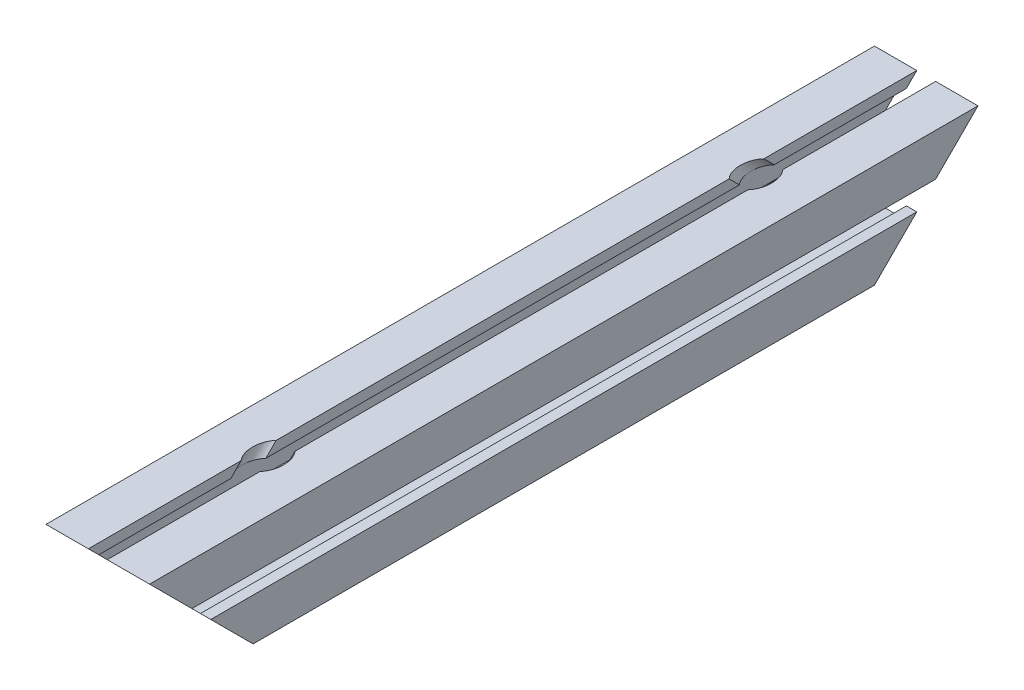
from build123d import *

# Parameters (mm, degrees)
SKETCH1_R      = 6
SKETCH1_R_2    = 3.75
EXTRUDE1_DEPTH = 180
EXTRUDE2_DEPTH = 187.899036916
SKETCH3_R      = 4.25
EXTRUDE3_DEPTH = 279.764013101
SKETCH4_R      = 6.75
SKETCH4_R_2    = 4.25
EXTRUDE4_DEPTH = 260.198128095


with BuildPart() as part:
    # Sketch1 → Extrude1 (new, symmetric)
    with BuildSketch(Plane.XY):
        Polygon((-18, -4.1), (-22.5, -4.1), (-22.5, -22.5), (-4.1, -22.5), (-4.1, -18), (-6.8, -18), (-6.8, -9.5), (-4.5, -7.2), (4.5, -7.2), (6.8, -9.5), (6.8, -18), (4.1, -18), (4.1, -22.5), (22.5, -22.5), (22.5, -4.1), (18, -4.1), (18, -6.8), (9.5, -6.8), (7.2, -4.5), (7.2, 4.5), (9.5, 6.8), (18, 6.8), (18, 4.1), (22.5, 4.1), (22.5, 22.5), (4.1, 22.5), (4.1, 18), (6.8, 18), (6.8, 9.5), (4.5, 7.2), (-4.5, 7.2), (-6.8, 9.5), (-6.8, 18), (-4.1, 18), (-4.1, 22.5), (-22.5, 22.5), (-22.5, 4.1), (-18, 4.1), (-18, 6.8), (-9.5, 6.8), (-7.2, 4.5), (-7.2, -4.5), (-9.5, -6.8), (-18, -6.8), align=None)
        with Locations(Location((14.65, -14.65, 0), (0, 0, 180))):
            Circle(SKETCH1_R, mode=Mode.SUBTRACT)
        with Locations(Location((-14.65, -14.65, 0), (0, 0, 180))):
            Circle(SKETCH1_R, mode=Mode.SUBTRACT)
        with Locations(Location((0, 0, 0), (0, 0, 180))):
            Circle(SKETCH1_R_2, mode=Mode.SUBTRACT)
        with Locations(Location((14.65, 14.65, 0), (0, 0, 180))):
            Circle(SKETCH1_R, mode=Mode.SUBTRACT)
        with Locations(Location((-14.65, 14.65, 0), (0, 0, 180))):
            Circle(SKETCH1_R, mode=Mode.SUBTRACT)
    extrude(amount=EXTRUDE1_DEPTH, both=True)

    # Sketch2 → Extrude2 (cut, through all)
    with BuildSketch(Plane(origin=(22.5, 0, 0), x_dir=(0, 0, -1), z_dir=(1, 0, 0))):
        Polygon((-161.6, 4.1), (-180, 4.1), (-180, -22.5), (-135, -22.5), align=None)
        Polygon((-180, 22.5), (-180, 4.1), (-161.6, 4.1), align=None)
        Polygon((180, 4.1), (161.6, 4.1), (135, -22.5), (180, -22.5), align=None)
        Polygon((180, 22.5), (161.6, 4.1), (180, 4.1), align=None)
    extrude(amount=-EXTRUDE2_DEPTH, mode=Mode.SUBTRACT)

    # Sketch3 → Extrude3 (cut, through all)
    with BuildSketch(Plane(origin=(0, -78.75, 78.75), x_dir=(1, 0, 0), z_dir=(0, -0.707106781186557, 0.7071067811865381))):
        with Locations(Location((0, 90.86512319, 0), (0, 0, 90))):
            Circle(SKETCH3_R)
    extrude3 = extrude(amount=-EXTRUDE3_DEPTH, mode=Mode.SUBTRACT)

    # Sketch4 → Extrude4 (cut, through all)
    with BuildSketch(Plane(origin=(0, -63.483564594, 63.483564594), x_dir=(1, 0, 0), z_dir=(0, -0.707106781186557, 0.7071067811865381))):
        with Locations(Location((0, 90.86512319, 0), (0, 0, 270))):
            Circle(SKETCH4_R)
        with Locations(Location((0, 90.86512319, 0), (0, 0, 329.882013033))):
            Circle(SKETCH4_R_2, mode=Mode.SUBTRACT)
    extrude4 = extrude(amount=-EXTRUDE4_DEPTH, mode=Mode.SUBTRACT)

    # Mirror1: Extrude3, Extrude4 across plane
    add(extrude3.mirror(Plane.XY), mode=Mode.SUBTRACT)
    add(extrude4.mirror(Plane.XY), mode=Mode.SUBTRACT)


solid = part.part
